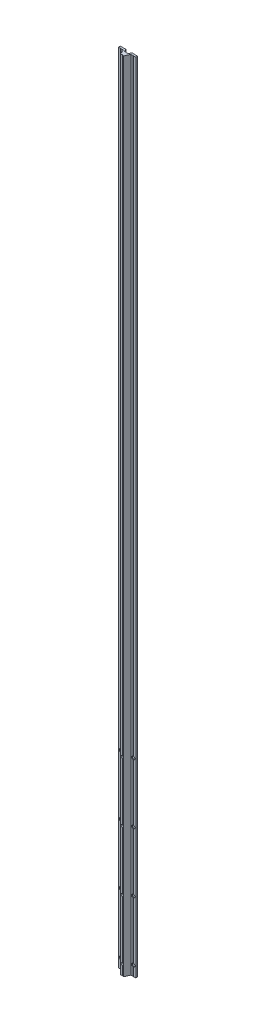
from build123d import *

# Parameters (mm, degrees)
RESSALTO_EXTRUS_O1_DEPTH = 2000
CORTE_EXTRUS_O1_DEPTH    = 2001.299713949
CORTE_EXTRUS_O2_DEPTH    = 2001.299713949
CORTE_EXTRUS_O3_DEPTH    = 2001.299713949
CORTE_EXTRUS_O4_DEPTH    = 2001.299713949
CORTE_EXTRUS_O5_DEPTH    = 2001.299713949
FURO1_D                  = 6.27
FURO1_DEPTH              = 17.276941944


with BuildPart() as part:
    # Esboço1 → Ressalto-extrusão1 (new body)
    with BuildSketch(Plane.XZ):
        Polygon((-21.925, -26.8), (21.925, -26.8), (21.925, -22.1), (9.425, -22.1), (3.8, -9.249864864), (0, -10.810968821), (-3.8, -9.249864864), (-9.425, -22.1), (-21.925, -22.1), align=None)
    extrude(amount=-RESSALTO_EXTRUS_O1_DEPTH)

    # Esboço2 → Corte-extrusão1 (cut, through all)
    with BuildSketch(Plane(origin=(0, 2000, 0), x_dir=(-1, 0, 0), z_dir=(0, 1, 0))):
        Polygon((-7.925, -26.8), (7.925, -26.8), (4.5, -20.3), (0.5, -20.3), (0, -19.8), (-0.5, -20.3), (-4.5, -20.3), align=None)
    extrude(amount=-CORTE_EXTRUS_O1_DEPTH, mode=Mode.SUBTRACT)

    # Esboço3 → Corte-extrusão2 (cut, through all)
    with BuildSketch(Plane(origin=(0, 2000, 0), x_dir=(-1, 0, 0), z_dir=(0, 1, 0))):
        Polygon((-15.175, -26.8), (-15.675, -26.3), (-16.175, -26.8), align=None)
    extrude(amount=-CORTE_EXTRUS_O2_DEPTH, mode=Mode.SUBTRACT)

    # Esboço4 → Corte-extrusão3 (cut, through all)
    with BuildSketch(Plane(origin=(0, 2000, 0), x_dir=(-1, 0, 0), z_dir=(0, 1, 0))):
        Polygon((-15.175, -22.1), (-16.175, -22.1), (-15.675, -22.6), align=None)
    extrude(amount=-CORTE_EXTRUS_O3_DEPTH, mode=Mode.SUBTRACT)

    # Esboço5 → Corte-extrusão4 (cut, through all)
    with BuildSketch(Plane(origin=(0, 2000, 0), x_dir=(-1, 0, 0), z_dir=(0, 1, 0))):
        Polygon((16.175, -22.1), (15.175, -22.1), (15.675, -22.6), align=None)
    extrude(amount=-CORTE_EXTRUS_O4_DEPTH, mode=Mode.SUBTRACT)

    # Esboço6 → Corte-extrusão5 (cut, through all)
    with BuildSketch(Plane(origin=(0, 2000, 0), x_dir=(-1, 0, 0), z_dir=(0, 1, 0))):
        Polygon((15.175, -26.8), (16.175, -26.8), (15.675, -26.3), align=None)
    extrude(amount=-CORTE_EXTRUS_O5_DEPTH, mode=Mode.SUBTRACT)

    # Esboço7 → Corte-Revolução1 (revolve, cut)
    with BuildSketch(Plane.XZ.offset(-325), mode=Mode.PRIVATE) as corte_revolu_o1_sk:
        Polygon((19.775, -22.1), (15.675, -22.1), (15.675, -26.8), (18.81, -26.8), (18.81, -23.065), align=None)
    revolve(corte_revolu_o1_sk.sketch.rotate(Axis((15.675, 325, -22.1), (0, 0, -1)), 180), axis=Axis((15.675, 325, -22.1), (0, 0, -1)), mode=Mode.SUBTRACT)

    # Esboço8 → Corte-Revolução2 (revolve, cut)
    with BuildSketch(Plane.XZ.offset(-475), mode=Mode.PRIVATE) as corte_revolu_o2_sk:
        Polygon((19.775, -22.1), (15.675, -22.1), (15.675, -26.8), (18.81, -26.8), (18.81, -23.065), align=None)
    revolve(corte_revolu_o2_sk.sketch.rotate(Axis((15.675, 475, -22.1), (0, 0, -1)), 180), axis=Axis((15.675, 475, -22.1), (0, 0, -1)), mode=Mode.SUBTRACT)

    # Esboço9 → Corte-Revolução3 (revolve, cut)
    with BuildSketch(Plane.XZ.offset(-25), mode=Mode.PRIVATE) as corte_revolu_o3_sk:
        Polygon((19.775, -22.1), (15.675, -22.1), (15.675, -26.8), (18.81, -26.8), (18.81, -23.065), align=None)
    revolve(corte_revolu_o3_sk.sketch.rotate(Axis((15.675, 25, -22.1), (0, 0, -1)), 277.004726435), axis=Axis((15.675, 25, -22.1), (0, 0, -1)), mode=Mode.SUBTRACT)

    # Esboço10 → Corte-Revolução4 (revolve, cut)
    with BuildSketch(Plane.XZ.offset(-175), mode=Mode.PRIVATE) as corte_revolu_o4_sk:
        Polygon((19.775, -22.1), (15.675, -22.1), (15.675, -26.8), (18.81, -26.8), (18.81, -23.065), align=None)
    revolve(corte_revolu_o4_sk.sketch.rotate(Axis((15.675, 175, -22.1), (0, 0, -1)), 180), axis=Axis((15.675, 175, -22.1), (0, 0, -1)), mode=Mode.SUBTRACT)

    # Esboço11 → Corte-Revolução5 (revolve, cut)
    with BuildSketch(Plane.XZ.offset(-175), mode=Mode.PRIVATE) as corte_revolu_o5_sk:
        Polygon((-11.575, -22.1), (-15.675, -22.1), (-15.675, -26.8), (-12.54, -26.8), (-12.54, -23.065), align=None)
    revolve(corte_revolu_o5_sk.sketch.rotate(Axis((-15.675, 175, -22.1), (0, 0, -1)), 277.004726436), axis=Axis((-15.675, 175, -22.1), (0, 0, -1)), mode=Mode.SUBTRACT)

    # Esboço12 → Corte-Revolução6 (revolve, cut)
    with BuildSketch(Plane.XZ.offset(-325), mode=Mode.PRIVATE) as corte_revolu_o6_sk:
        Polygon((-11.575, -22.1), (-15.675, -22.1), (-15.675, -26.8), (-12.54, -26.8), (-12.54, -23.065), align=None)
    revolve(corte_revolu_o6_sk.sketch.rotate(Axis((-15.675, 325, -22.1), (0, 0, -1)), 277.004726436), axis=Axis((-15.675, 325, -22.1), (0, 0, -1)), mode=Mode.SUBTRACT)

    # Esboço13 → Corte-Revolução7 (revolve, cut)
    with BuildSketch(Plane.XZ.offset(-475), mode=Mode.PRIVATE) as corte_revolu_o7_sk:
        Polygon((-11.575, -22.1), (-15.675, -22.1), (-15.675, -26.8), (-12.54, -26.8), (-12.54, -23.065), align=None)
    revolve(corte_revolu_o7_sk.sketch.rotate(Axis((-15.675, 475, -22.1), (0, 0, -1)), 277.004726436), axis=Axis((-15.675, 475, -22.1), (0, 0, -1)), mode=Mode.SUBTRACT)

    # Esboço14 → Corte-Revolução8 (revolve, cut)
    with BuildSketch(Plane.XZ.offset(-25), mode=Mode.PRIVATE) as corte_revolu_o8_sk:
        Polygon((-11.575, -22.1), (-15.675, -22.1), (-15.675, -26.8), (-12.54, -26.8), (-12.54, -23.065), align=None)
    revolve(corte_revolu_o8_sk.sketch.rotate(Axis((-15.675, 25, -22.1), (0, 0, -1)), 277.004726436), axis=Axis((-15.675, 25, -22.1), (0, 0, -1)), mode=Mode.SUBTRACT)

    # Furo1
    with Locations(Plane.XY.offset(-9.523058056)):
        with Locations((0, 175), (0, 25), (0, 475), (0, 325)):
            Hole(FURO1_D / 2, depth=FURO1_DEPTH)


solid = part.part
